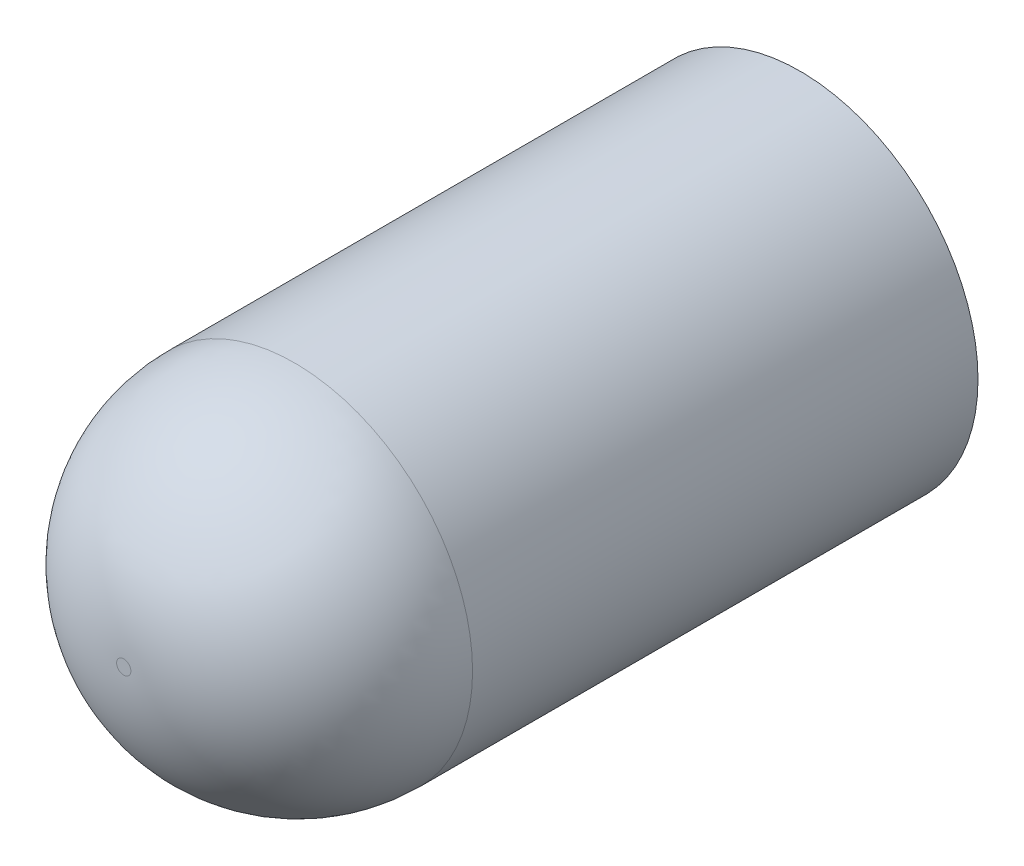
from build123d import *

# Parameters (mm, degrees)
EXTRUDE_1_DEPTH      = 2.5
EXTRUDE_1_DEPTH_BACK = 7
SKETCH_1_R           = 2.5
FILLET_1_R           = 2.4


with BuildPart() as part:
    # Эскиз1 → Бобышка-Вытянуть1 (new, two sides: drawn at the far end of the back side and taken through both)
    with BuildSketch(Plane.XY.offset(-EXTRUDE_1_DEPTH_BACK)):
        with Locations((0, 15)):
            Circle(SKETCH_1_R)
    extrude(amount=EXTRUDE_1_DEPTH + EXTRUDE_1_DEPTH_BACK)

    # Скругление1
    fillet_1_edges = [part.edges().sort_by_distance(p)[0] for p in [
        (-2.5, 15, 2.5),
    ]]
    fillet(fillet_1_edges, radius=FILLET_1_R)


solid = part.part
